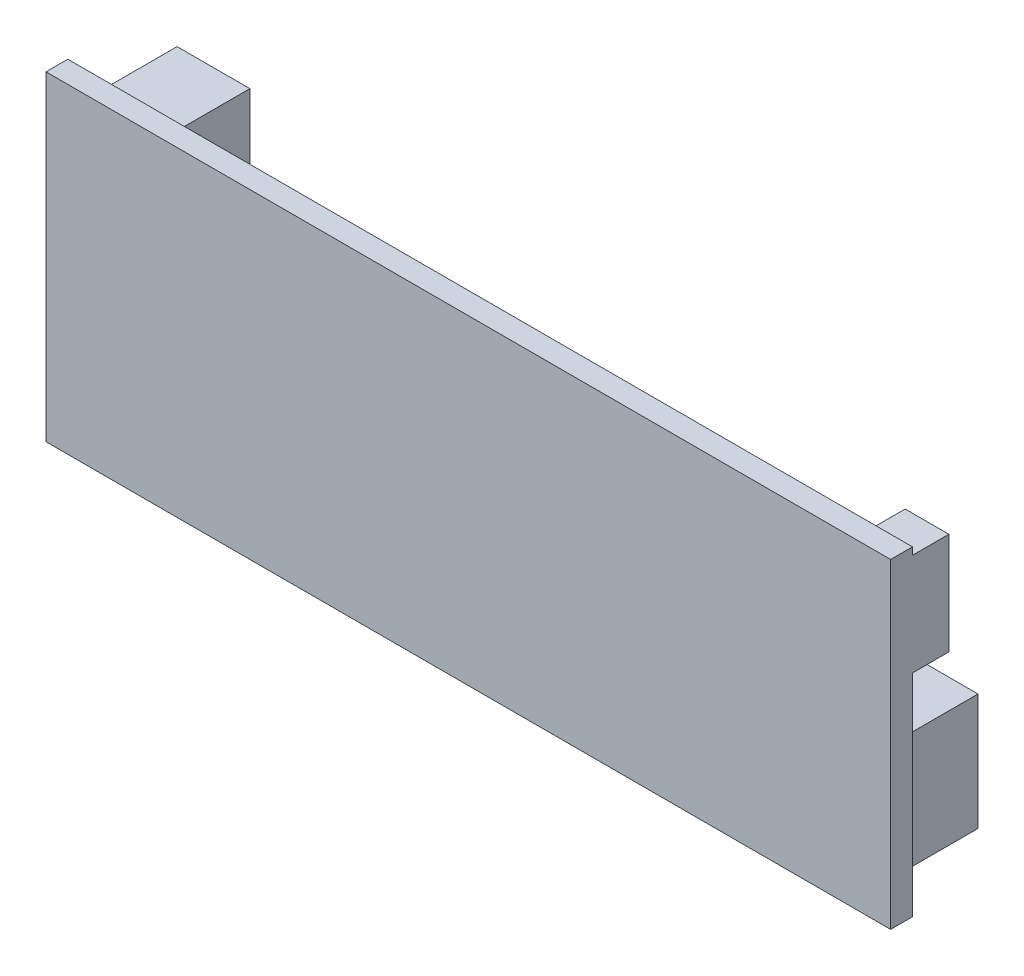
from build123d import *

# Parameters (mm, degrees)
SKETCH1_W           = 58
SKETCH1_H           = 22
BOSS_EXTRUDE1_DEPTH = 1.5
SKETCH2_W           = 5
SKETCH2_H           = 5
SKETCH2_W_2         = 1.5
SKETCH2_H_2         = 4.802137959
SKETCH2_W_3         = 3
SKETCH2_H_3         = 7
SKETCH2_W_4         = 8
SKETCH2_H_4         = 8
BOSS_EXTRUDE2_DEPTH = 2.5
SKETCH3_W           = 1.5
SKETCH3_H           = 4.802137959
SKETCH3_W_2         = 5
SKETCH3_H_2         = 5
SKETCH3_W_3         = 8
SKETCH3_H_3         = 8
BOSS_EXTRUDE3_DEPTH = 3.5


with BuildPart() as part:
    # Sketch1 → Boss-Extrude1 (new body)
    with BuildSketch(Plane.XY):
        with Locations((9.718487395, 11)):
            Rectangle(SKETCH1_W, SKETCH1_H)
    extrude(amount=BOSS_EXTRUDE1_DEPTH)

    # Sketch2 → Boss-Extrude2 (add)
    with BuildSketch(Plane(origin=(0, 0, 0), x_dir=(-1, 0, 0), z_dir=(0, 0, -1))):
        with Locations((15.281512605, 18)):
            Rectangle(SKETCH2_W, SKETCH2_H)
        with Locations((18.531512605, 5.498931021)):
            Rectangle(SKETCH2_W_2, SKETCH2_H_2)
        with Locations((-37.218487395, 18)):
            Rectangle(SKETCH2_W_3, SKETCH2_H_3)
        with Locations((-33.218487395, 5.5)):
            Rectangle(SKETCH2_W_4, SKETCH2_H_4)
    extrude(amount=BOSS_EXTRUDE2_DEPTH)

    # Sketch3 → Boss-Extrude3 (add)
    with BuildSketch(Plane(origin=(0, 0, -2.5), x_dir=(-1, 0, 0), z_dir=(0, 0, -1))):
        with Locations((18.531512605, 5.498931021)):
            Rectangle(SKETCH3_W, SKETCH3_H)
        with Locations((15.281512605, 18)):
            Rectangle(SKETCH3_W_2, SKETCH3_H_2)
        with Locations((-33.218487395, 5.5)):
            Rectangle(SKETCH3_W_3, SKETCH3_H_3)
    extrude(amount=BOSS_EXTRUDE3_DEPTH)


solid = part.part
